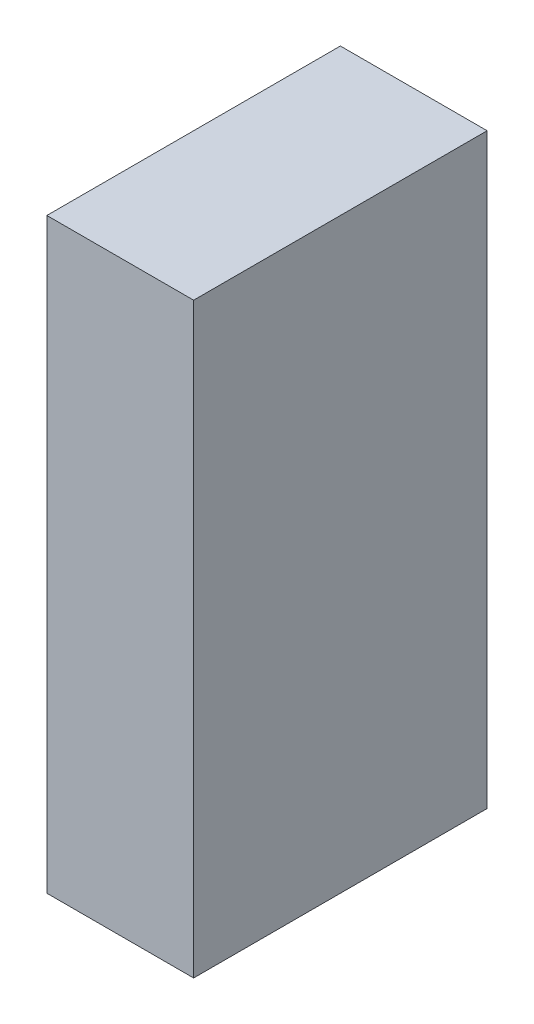
from build123d import *

# Parameters (mm, degrees)
SKETCH1_W           = 25.4
SKETCH1_H           = 50.8
BOSS_EXTRUDE1_DEPTH = 101.6


with BuildPart() as part:
    # Sketch1 → Boss-Extrude1 (new body)
    with BuildSketch(Plane(origin=(0, 0, 0), x_dir=(1, 0, 0), z_dir=(0, 1, 0))):
        with Locations((-56.270085587, -10.665607255)):
            Rectangle(SKETCH1_W, SKETCH1_H)
    extrude(amount=-BOSS_EXTRUDE1_DEPTH)


solid = part.part
